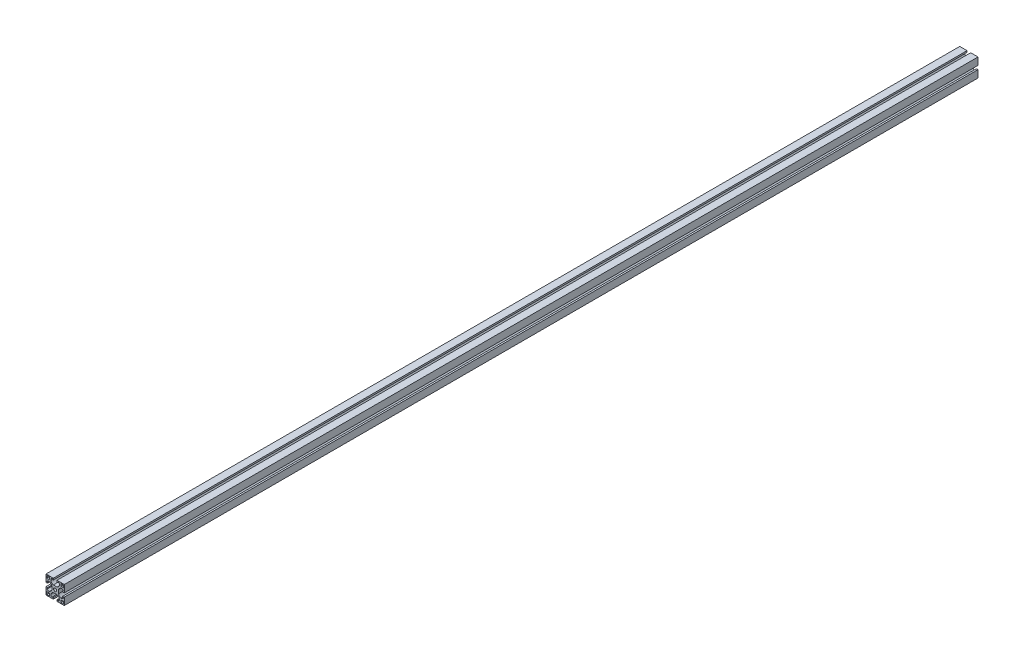
from build123d import *

# Parameters (mm, degrees)
CROQUIS1_W              = 5.700927171
CROQUIS1_H              = 5.669703343
CROQUIS1_W_2            = 5.669703343
CROQUIS1_H_2            = 5.700927171
SALIENTE_EXTRUIR1_DEPTH = 2000


with BuildPart() as part:
    # Croquis1 → Saliente-Extruir1 (new body)
    with BuildSketch(Plane.XY):
        with BuildLine():
            Line((16, 0), (16, 3.526999273))
            Line((16, 3.526999273), (13.842037149, 3.526999273))
            Line((13.842037149, 3.526999273), (13.842037149, 1.764099906))
            ThreePointArc((13.842037149, 1.764099906), (11.014894419, 3.909691284), (10.589261103, 7.433202979))
            ThreePointArc((10.589261103, 7.433202979), (12.773071968, 10.642430452), (16, 12.8))
            Line((16, 12.8), (20, 12.8))
            Line((20, 12.8), (24, 12.8))
            ThreePointArc((24, 12.8), (27.226928032, 10.642430452), (29.410738897, 7.433202979))
            ThreePointArc((29.410738897, 7.433202979), (28.985105581, 3.909691284), (26.157962851, 1.764099906))
            Line((26.157962851, 1.764099906), (26.157962851, 3.526999273))
            Line((26.157962851, 3.526999273), (24, 3.526999273))
            Line((24, 3.526999273), (24, 0))
            Line((24, 0), (40, 0))
            Line((40, 0), (40, 16))
            Line((40, 16), (36.473000727, 16))
            Line((36.473000727, 16), (36.473000727, 13.842037149))
            Line((36.473000727, 13.842037149), (38.235900094, 13.842037149))
            ThreePointArc((38.235900094, 13.842037149), (36.090308716, 11.014894419), (32.566797021, 10.589261103))
            ThreePointArc((32.566797021, 10.589261103), (29.357569548, 12.773071968), (27.2, 16))
            Line((27.2, 16), (27.2, 20))
            Line((27.2, 20), (27.2, 24))
            ThreePointArc((27.2, 24), (29.357569548, 27.226928032), (32.566797021, 29.410738897))
            ThreePointArc((32.566797021, 29.410738897), (36.090308716, 28.985105581), (38.235900094, 26.157962851))
            Line((38.235900094, 26.157962851), (36.473000727, 26.157962851))
            Line((36.473000727, 26.157962851), (36.473000727, 24))
            Line((36.473000727, 24), (40, 24))
            Line((40, 24), (40, 40))
            Line((40, 40), (24, 40))
            Line((24, 40), (24, 36.473000727))
            Line((24, 36.473000727), (26.157962851, 36.473000727))
            Line((26.157962851, 36.473000727), (26.157962851, 38.235900094))
            ThreePointArc((26.157962851, 38.235900094), (28.985105581, 36.090308716), (29.410738897, 32.566797021))
            ThreePointArc((29.410738897, 32.566797021), (27.226928032, 29.357569548), (24, 27.2))
            Line((24, 27.2), (20, 27.2))
            Line((20, 27.2), (16, 27.2))
            ThreePointArc((16, 27.2), (12.773071968, 29.357569548), (10.589261103, 32.566797021))
            ThreePointArc((10.589261103, 32.566797021), (11.014894419, 36.090308716), (13.842037149, 38.235900094))
            Line((13.842037149, 38.235900094), (13.842037149, 36.473000727))
            Line((13.842037149, 36.473000727), (16, 36.473000727))
            Line((16, 36.473000727), (16, 40))
            Line((16, 40), (0, 40))
            Line((0, 40), (0, 24))
            Line((0, 24), (3.526999273, 24))
            Line((3.526999273, 24), (3.526999273, 26.157962851))
            Line((3.526999273, 26.157962851), (1.764099906, 26.157962851))
            ThreePointArc((1.764099906, 26.157962851), (3.909691284, 28.985105581), (7.433202979, 29.410738897))
            ThreePointArc((7.433202979, 29.410738897), (10.642430452, 27.226928032), (12.8, 24))
            Line((12.8, 24), (12.8, 20))
            Line((12.8, 20), (12.8, 16))
            ThreePointArc((12.8, 16), (10.642430452, 12.773071968), (7.433202979, 10.589261103))
            ThreePointArc((7.433202979, 10.589261103), (3.909691284, 11.014894419), (1.764099906, 13.842037149))
            Line((1.764099906, 13.842037149), (3.526999273, 13.842037149))
            Line((3.526999273, 13.842037149), (3.526999273, 16))
            Line((3.526999273, 16), (0, 16))
            Line((0, 16), (0, 0))
            Line((0, 0), (16, 0))
        make_face()
        with Locations((4.415111636, 4.598351308)):
            Rectangle(CROQUIS1_W, CROQUIS1_H, mode=Mode.SUBTRACT)
        with Locations((4.598351308, 35.584888365)):
            Rectangle(CROQUIS1_W_2, CROQUIS1_H_2, mode=Mode.SUBTRACT)
        with Locations((35.584888365, 35.401648693)):
            Rectangle(CROQUIS1_W, CROQUIS1_H, mode=Mode.SUBTRACT)
        with Locations((35.401648693, 4.415111636)):
            Rectangle(CROQUIS1_W_2, CROQUIS1_H_2, mode=Mode.SUBTRACT)
        with BuildLine():
            ThreePointArc((16.6, 20), (17.595836944, 17.595836944), (20, 16.6))
            ThreePointArc((20, 16.6), (22.404163056, 17.595836944), (23.4, 20))
            ThreePointArc((23.4, 20), (22.404163056, 22.404163056), (20, 23.4))
            ThreePointArc((20, 23.4), (17.595836944, 22.404163056), (16.6, 20))
        make_face(mode=Mode.SUBTRACT)
    extrude(amount=SALIENTE_EXTRUIR1_DEPTH)


solid = part.part
